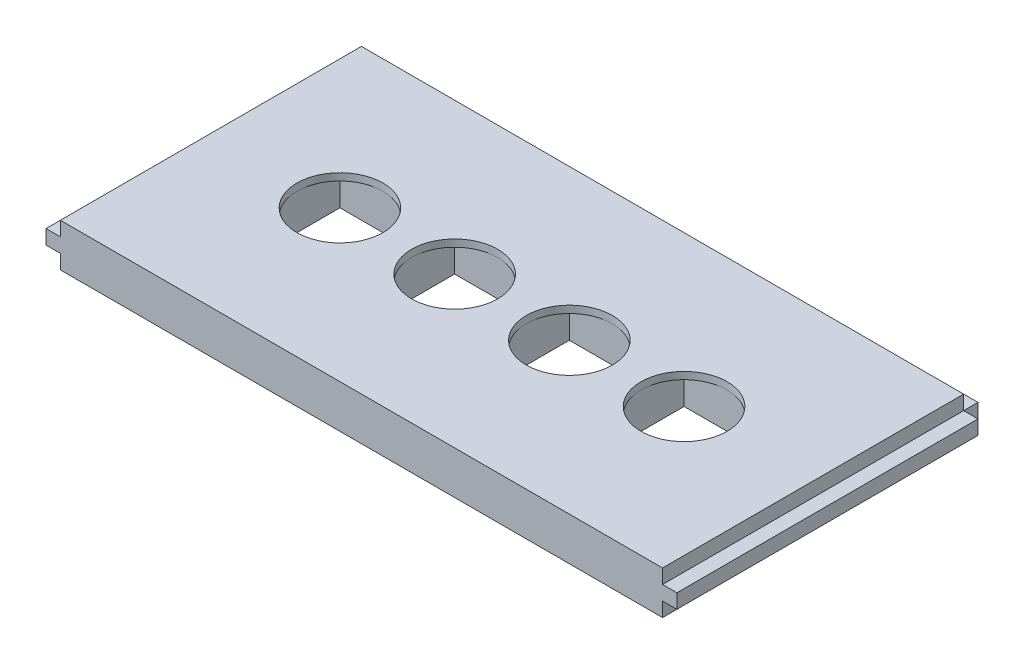
from build123d import *

# Parameters (mm, degrees)
SKETCH_1_W          = 42
SKETCH_1_H          = 21
EXTRUDE_1_DEPTH     = 3
SKETCH_2_R          = 3
CUT_EXTRUDE_4_DEPTH = 3
CUT_EXTRUDE_6_DEPTH = 2.5
SKETCH_5_W          = 21
SKETCH_5_H          = 1
EXTRUDE_2_DEPTH     = 1
SKETCH_7_W          = 42
SKETCH_7_H          = 1
EXTRUDE_3_DEPTH     = 1
SKETCH_8_W          = 21
SKETCH_8_H          = 1
EXTRUDE_4_DEPTH     = 1


with BuildPart() as part:
    # Эскиз1 → Бобышка-Вытянуть1 (new body)
    with BuildSketch(Plane(origin=(0, 0, 0), x_dir=(1, 0, 0), z_dir=(0, 1, 0))):
        with Locations((21, -10.5)):
            Rectangle(SKETCH_1_W, SKETCH_1_H)
    extrude(amount=EXTRUDE_1_DEPTH)

    # Эскиз2 → Вырез-Вытянуть4 (cut)
    with BuildSketch(Plane.XZ):
        with Locations((17, 10.5)):
            Circle(SKETCH_2_R)
        with Locations((9, 10.5)):
            Circle(SKETCH_2_R)
        with Locations((25, 10.5)):
            Circle(SKETCH_2_R)
        with Locations((33, 10.5)):
            Circle(SKETCH_2_R)
    extrude(amount=-CUT_EXTRUDE_4_DEPTH, mode=Mode.SUBTRACT)

    # Эскиз2<5> → Вырез-Вытянуть6 (cut)
    with BuildSketch(Plane.XZ):
        with BuildLine():
            Line((17, 13.5), (14, 13.5))
            Line((14, 13.5), (14, 10.5))
            ThreePointArc((14, 10.5), (14.878679656, 12.621320344), (17, 13.5))
        make_face()
        with BuildLine():
            Line((20, 13.5), (17, 13.5))
            ThreePointArc((17, 13.5), (19.121320344, 12.621320344), (20, 10.5))
            Line((20, 10.5), (20, 13.5))
        make_face()
        with BuildLine():
            ThreePointArc((17, 7.5), (14.878679656, 8.378679656), (14, 10.5))
            Line((14, 10.5), (14, 7.5))
            Line((14, 7.5), (17, 7.5))
        make_face()
        with BuildLine():
            Line((20, 7.5), (20, 10.5))
            ThreePointArc((20, 10.5), (19.121320344, 8.378679656), (17, 7.5))
            Line((17, 7.5), (20, 7.5))
        make_face()
        with BuildLine():
            Line((9, 13.5), (6, 13.5))
            Line((6, 13.5), (6, 10.5))
            ThreePointArc((6, 10.5), (6.878679656, 12.621320344), (9, 13.5))
        make_face()
        with BuildLine():
            Line((12, 13.5), (9, 13.5))
            ThreePointArc((9, 13.5), (11.121320344, 12.621320344), (12, 10.5))
            Line((12, 10.5), (12, 13.5))
        make_face()
        with BuildLine():
            ThreePointArc((9, 7.5), (6.878679656, 8.378679656), (6, 10.5))
            Line((6, 10.5), (6, 7.5))
            Line((6, 7.5), (9, 7.5))
        make_face()
        with BuildLine():
            Line((12, 7.5), (12, 10.5))
            ThreePointArc((12, 10.5), (11.121320344, 8.378679656), (9, 7.5))
            Line((9, 7.5), (12, 7.5))
        make_face()
        with BuildLine():
            Line((25, 13.5), (22, 13.5))
            Line((22, 13.5), (22, 10.5))
            ThreePointArc((22, 10.5), (22.878679656, 12.621320344), (25, 13.5))
        make_face()
        with BuildLine():
            Line((28, 13.5), (25, 13.5))
            ThreePointArc((25, 13.5), (27.121320344, 12.621320344), (28, 10.5))
            Line((28, 10.5), (28, 13.5))
        make_face()
        with BuildLine():
            ThreePointArc((25, 7.5), (22.878679656, 8.378679656), (22, 10.5))
            Line((22, 10.5), (22, 7.5))
            Line((22, 7.5), (25, 7.5))
        make_face()
        with BuildLine():
            Line((28, 7.5), (28, 10.5))
            ThreePointArc((28, 10.5), (27.121320344, 8.378679656), (25, 7.5))
            Line((25, 7.5), (28, 7.5))
        make_face()
        with BuildLine():
            Line((33, 13.5), (30, 13.5))
            Line((30, 13.5), (30, 10.5))
            ThreePointArc((30, 10.5), (30.878679656, 12.621320344), (33, 13.5))
        make_face()
        with BuildLine():
            Line((36, 13.5), (33, 13.5))
            ThreePointArc((33, 13.5), (35.121320344, 12.621320344), (36, 10.5))
            Line((36, 10.5), (36, 13.5))
        make_face()
        with BuildLine():
            ThreePointArc((33, 7.5), (30.878679656, 8.378679656), (30, 10.5))
            Line((30, 10.5), (30, 7.5))
            Line((30, 7.5), (33, 7.5))
        make_face()
        with BuildLine():
            Line((36, 7.5), (36, 10.5))
            ThreePointArc((36, 10.5), (35.121320344, 8.378679656), (33, 7.5))
            Line((33, 7.5), (36, 7.5))
        make_face()
    extrude(amount=-CUT_EXTRUDE_6_DEPTH, mode=Mode.SUBTRACT)

    # Эскиз5 → Бобышка-Вытянуть2 (add)
    with BuildSketch(Plane(origin=(42, 0, 0), x_dir=(0, 0, -1), z_dir=(1, 0, 0))):
        with Locations((-10.5, 1.5)):
            Rectangle(SKETCH_5_W, SKETCH_5_H)
    extrude(amount=EXTRUDE_2_DEPTH)

    # Эскиз7 → Бобышка-Вытянуть3 (add)
    with BuildSketch(Plane(origin=(0, 0, 0), x_dir=(-1, 0, 0), z_dir=(0, 0, -1))):
        with Locations((-21, 1.5)):
            Rectangle(SKETCH_7_W, SKETCH_7_H)
    extrude(amount=EXTRUDE_3_DEPTH)

    # Эскиз8 → Бобышка-Вытянуть4 (add)
    with BuildSketch(Plane.ZY):
        with Locations((10.5, 1.5)):
            Rectangle(SKETCH_8_W, SKETCH_8_H)
    extrude(amount=EXTRUDE_4_DEPTH)


solid = part.part
